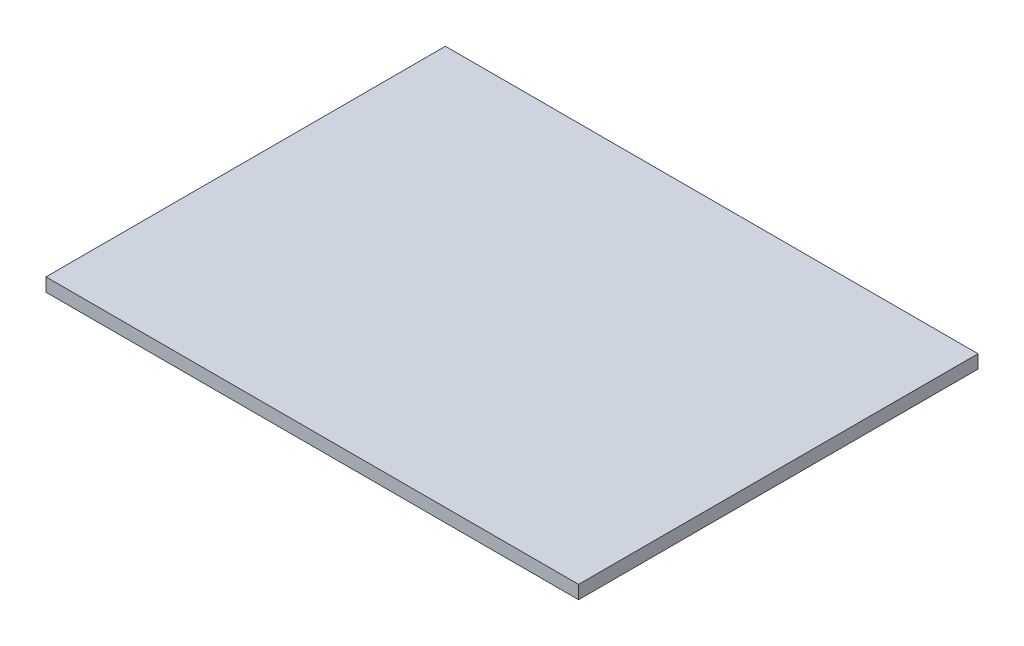
from build123d import *

# Parameters (mm, degrees)
SKETCH_1_W      = 200
SKETCH_1_H      = 150
EXTRUDE_1_DEPTH = 5


with BuildPart() as part:
    # 스케치1 → 보스-돌출1 (new body)
    with BuildSketch(Plane(origin=(0, 0, 0), x_dir=(1, 0, 0), z_dir=(0, 1, 0))):
        Rectangle(SKETCH_1_W, SKETCH_1_H)
    extrude(amount=EXTRUDE_1_DEPTH)


solid = part.part
